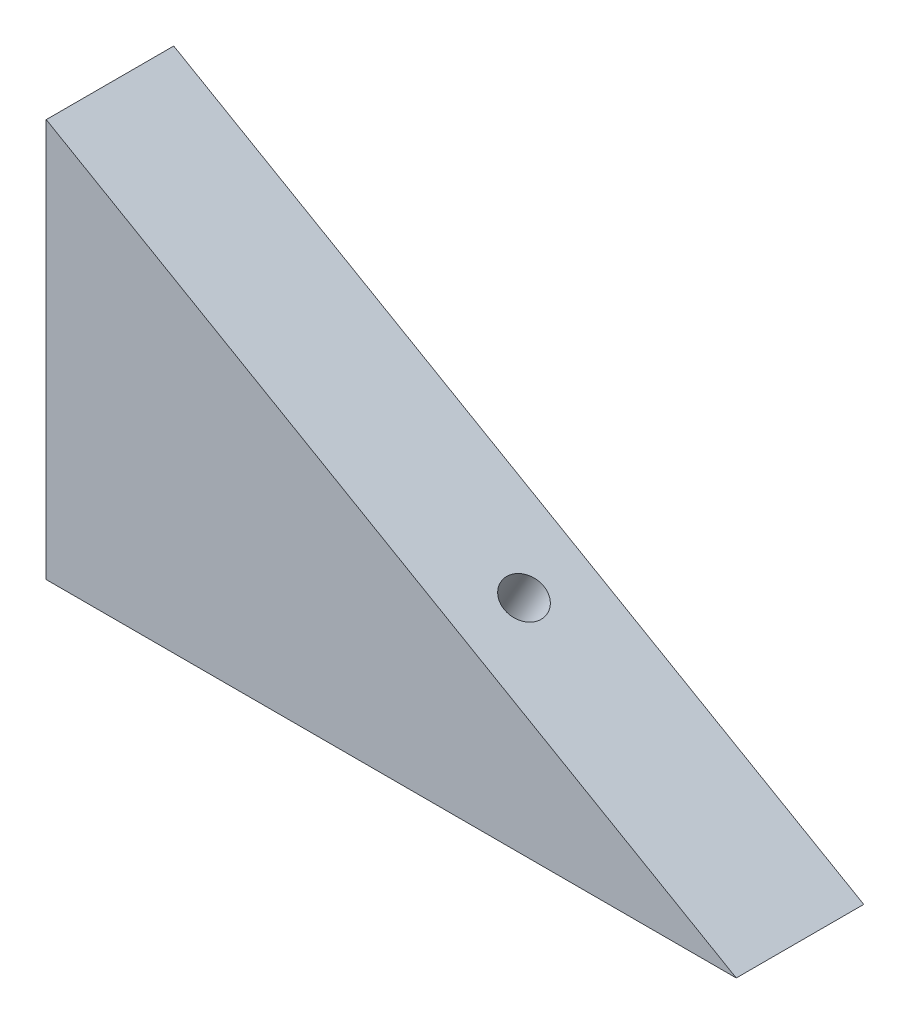
from build123d import *

# Parameters (mm, degrees)
EXTRUDE_2_DEPTH        = 8
HOLE_WIZARD_M3_1_D     = 2.5
HOLE_WIZARD_M3_1_DEPTH = 5
HOLE_WIZARD_M3_2_D     = 2.5
HOLE_WIZARD_M3_2_DEPTH = 5


with BuildPart() as part:
    # 草图1 → 凸台-拉伸2 (new body)
    with BuildSketch(Plane.XY):
        Polygon((-42.3029947, -7.235847593), (-42.3029947, -32.235847593), (0.998275489, -32.235847593), align=None)
    extrude(amount=EXTRUDE_2_DEPTH)

    # M3 螺纹孔1
    with Locations(Plane.ZY.offset(42.3029947)):
        with Locations((4, -22.235847593)):
            Hole(HOLE_WIZARD_M3_1_D / 2, depth=HOLE_WIZARD_M3_1_DEPTH)

    # M3 螺纹孔2
    with Locations(Plane(origin=(-13.708962592, -23.744619728, 0), x_dir=(0.8660254037844363, -0.5000000000000042, 0), z_dir=(0.5000000000000042, 0.8660254037844363, 0))):
        with Locations((-3.01754427, -4)):
            Hole(HOLE_WIZARD_M3_2_D / 2, depth=HOLE_WIZARD_M3_2_DEPTH)


solid = part.part
